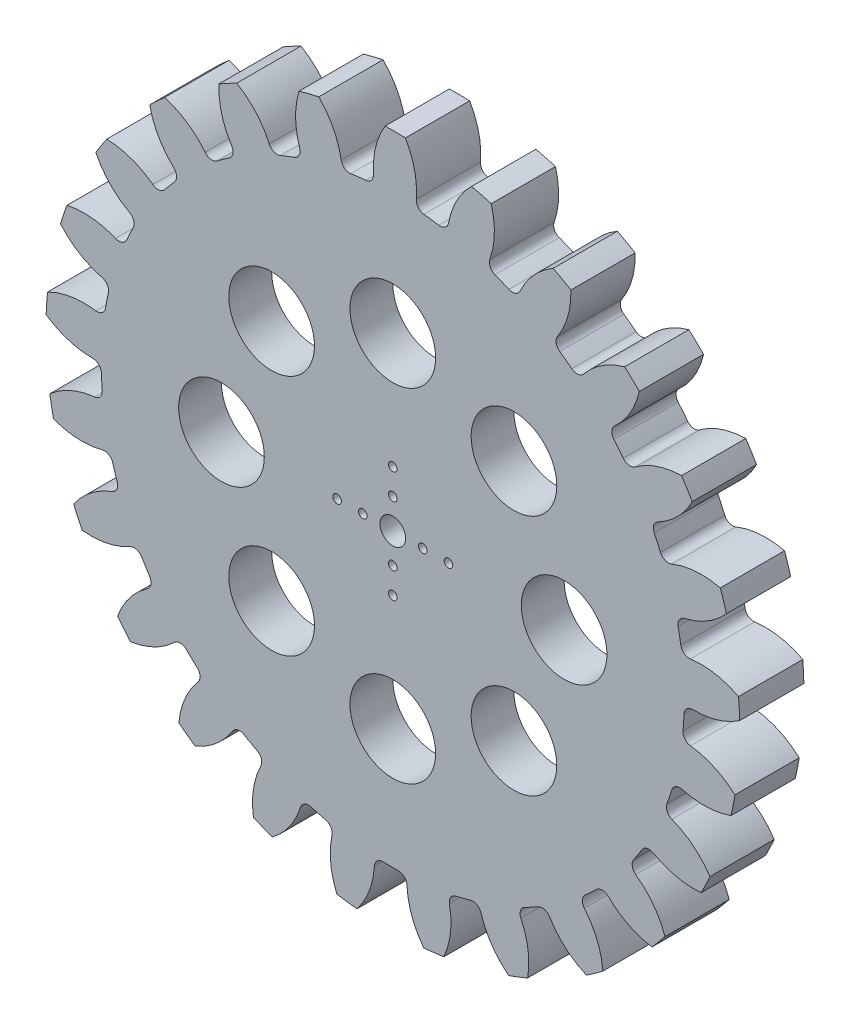
from build123d import *

# Parameters (mm, degrees)
SKETCH12_R               = 68.058
BOSS_EXTRUDE2_DEPTH      = 7.5
BOSS_EXTRUDE3_DEPTH      = 7.5
FILLET1_R                = 2
CIRPATTERN2_COUNT        = 25
FILLET1_OF_CIRPATTERN2_R = 2
CROQUIS1_R               = 1
CORTAR_EXTRUIR1_DEPTH    = 15
CROQUIS2_R               = 2
CORTAR_EXTRUIR2_DEPTH    = 15
SKETCH14_R               = 1
CUT_EXTRUDE1_DEPTH       = 15
SKETCH15_R               = 10
CUT_EXTRUDE2_DEPTH       = 25
SKETCH16_R               = 57.5
SKETCH16_R_2             = 20
CUT_EXTRUDE3_DEPTH       = 5
SKETCH17_R               = 3
CUT_EXTRUDE4_DEPTH       = 15


with BuildPart() as part:
    # Sketch12 → Boss-Extrude2 (new, symmetric)
    with BuildSketch(Plane.XY):
        Circle(SKETCH12_R)
    extrude(amount=BOSS_EXTRUDE2_DEPTH, both=True)

    # Sketch13 → Boss-Extrude3 (add, symmetric)
    with BuildSketch(Plane.XY):
        with BuildLine():
            ThreePointArc((-28.125648846, 61.974504766), (-32.366218452, 59.869184621), (-36.450160371, 57.474143516))
            ThreePointArc((-36.450160371, 57.474143516), (-39.675483485, 63.406008385), (-40.590482306, 70.095739857))
            ThreePointArc((-40.590482306, 70.095739857), (-38.521021696, 71.253988573), (-36.418540173, 72.351157086))
            ThreePointArc((-36.418540173, 72.351157086), (-31.322395625, 67.921818449), (-28.125648846, 61.974504766))
        make_face()
    boss_extrude3 = extrude(amount=BOSS_EXTRUDE3_DEPTH, both=True)

    # Fillet1
    fillet1_edges = [part.edges().sort_by_distance(p)[0] for p in [
        (-28.125648846, 61.974504766, 0),
        (-36.450160371, 57.474143516, 0),
    ]]
    fillet(fillet1_edges, radius=FILLET1_R)

    # CirPattern2: Boss-Extrude3 ×25 about axis
    cirpattern2_axis = Axis((0, 0, 0), (0, 0, 1))
    for i in range(1, CIRPATTERN2_COUNT):
        add(boss_extrude3.rotate(cirpattern2_axis, i * 360 / CIRPATTERN2_COUNT))

    # Fillet1 of CirPattern2
    fillet1_of_cirpattern2_edges = [part.edges().sort_by_distance(p)[0] for p in [
        (-42.654462466, 53.032897297, 0),
        (-49.598249822, 46.60370134, 0),
        (-54.503139336, 40.75903785, 0),
        (-59.629898827, 32.804977213, 0),
        (-62.927183514, 25.924138154, 0),
        (-65.914781985, 16.944995719, 0),
        (-67.397281321, 9.460329515, 0),
        (-68.057996973, 0.020297824, 0),
        (-67.632560073, -7.59790642, 0),
        (-65.924877712, -16.905675457, 0),
        (-63.618236341, -24.178737951, 0),
        (-59.649455929, -32.769402975, 0),
        (-55.606544847, -39.240330454, 0),
        (-49.626039455, -46.574108386, 0),
        (-44.100889635, -51.836308679, 0),
        (-36.484436411, -57.45239128, 0),
        (-29.824213335, -61.175220988, 0),
        (-21.050382046, -64.720729135, 0),
        (-13.673572025, -66.670269177, 0),
        (-4.293654759, -67.922425552, 0),
        (3.336230103, -67.976179156, 0),
        (12.732858647, -66.85630617, 0),
        (20.136404624, -65.010895801, 0),
        (28.959319716, -61.589359191, 0),
        (35.671334785, -57.960738769, 0),
        (43.366160223, -52.452526265, 0),
        (48.964903793, -47.268695355, 0),
        (55.048145393, -40.019908206, 0),
        (59.181827814, -33.60658597, 0),
        (63.271253135, -25.072692132, 0),
        (65.680139938, -17.832851193, 0),
        (67.518795347, -8.5500666, 0),
        (68.051527316, -0.93861279, 0),
        (67.523883331, 8.509791061, 0),
        (66.146986956, 16.014602106, 0),
        (63.28619739, 25.034947253, 0),
        (60.086188134, 31.961560655, 0),
        (55.072006916, 39.987065637, 0),
        (50.24995313, 45.900256801, 0),
        (43.397439707, 52.426649624, 0),
        (37.256328765, 56.954871003, 0),
        (28.996051757, 61.572074405, 0),
        (21.921752244, 64.430801194, 0),
        (12.772735235, 66.848699304, 0),
        (5.209751407, 67.858307187, 0),
        (-4.253139217, 67.924974573, 0),
        (-11.829597271, 67.022026174, 0),
        (-21.01177329, 64.73327388, 0),
    ]]
    fillet(fillet1_of_cirpattern2_edges, radius=FILLET1_OF_CIRPATTERN2_R)

    # Croquis1 → Cortar-Extruir1 (cut)
    with BuildSketch(Plane(origin=(0, 0, -7.5), x_dir=(-1, 0, 0), z_dir=(0, 0, -1))):
        with Locations((7, 0)):
            Circle(CROQUIS1_R)
        with Locations((13, 0)):
            Circle(CROQUIS1_R)
        with Locations((-7, 0)):
            Circle(CROQUIS1_R)
        with Locations((-13, 0)):
            Circle(CROQUIS1_R)
    extrude(amount=-CORTAR_EXTRUIR1_DEPTH, mode=Mode.SUBTRACT)

    # Croquis2 → Cortar-Extruir2 (cut)
    with BuildSketch(Plane(origin=(0, 0, -7.5), x_dir=(-1, 0, 0), z_dir=(0, 0, -1))):
        Circle(CROQUIS2_R)
    extrude(amount=-CORTAR_EXTRUIR2_DEPTH, mode=Mode.SUBTRACT)

    # Sketch14 → Cut-Extrude1 (cut)
    with BuildSketch(Plane(origin=(0, 0, -7.5), x_dir=(-1, 0, 0), z_dir=(0, 0, -1))):
        with Locations((0, 7)):
            Circle(SKETCH14_R)
        with Locations((0, 13)):
            Circle(SKETCH14_R)
        with Locations((0, -7)):
            Circle(SKETCH14_R)
        with Locations((0, -13)):
            Circle(SKETCH14_R)
    extrude(amount=-CUT_EXTRUDE1_DEPTH, mode=Mode.SUBTRACT)

    # Sketch15 → Cut-Extrude2 (cut)
    with BuildSketch(Plane(origin=(0, 0, -7.5), x_dir=(-1, 0, 0), z_dir=(0, 0, -1))):
        with Locations((0, 40)):
            Circle(SKETCH15_R)
        with Locations((28.284271247, 28.284271247)):
            Circle(SKETCH15_R)
        with Locations((40, 0)):
            Circle(SKETCH15_R)
        with Locations((28.284271247, -28.284271247)):
            Circle(SKETCH15_R)
        with Locations((0, -40)):
            Circle(SKETCH15_R)
        with Locations((-28.284271247, -28.284271247)):
            Circle(SKETCH15_R)
        with Locations((-40, 0)):
            Circle(SKETCH15_R)
        with Locations((-28.284271247, 28.284271247)):
            Circle(SKETCH15_R)
    extrude(amount=-CUT_EXTRUDE2_DEPTH, mode=Mode.SUBTRACT)

    # Sketch16 → Cut-Extrude3 (cut)
    with BuildSketch(Plane(origin=(0, 0, -7.5), x_dir=(-1, 0, 0), z_dir=(0, 0, -1))):
        Circle(SKETCH16_R)
        Circle(SKETCH16_R_2, mode=Mode.SUBTRACT)
    extrude(amount=-CUT_EXTRUDE3_DEPTH, mode=Mode.SUBTRACT)

    # Sketch17 → Cut-Extrude4 (cut)
    with BuildSketch(Plane.XY.offset(7.5)):
        Circle(SKETCH17_R)
    extrude(amount=-CUT_EXTRUDE4_DEPTH, mode=Mode.SUBTRACT)


solid = part.part
